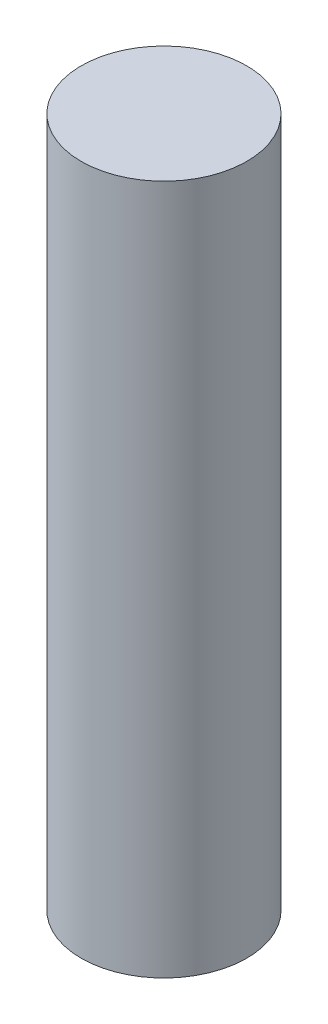
from build123d import *

# Parameters (mm, degrees)
ESBO_O1_R                = 30
RESSALTO_EXTRUS_O1_DEPTH = 250


with BuildPart() as part:
    # Esboço1 → Ressalto-extrusão1 (new body)
    with BuildSketch(Plane(origin=(0, 0, 0), x_dir=(1, 0, 0), z_dir=(0, 1, 0))):
        with Locations(Location((0, 0, 0), (0, 0, 270))):
            Circle(ESBO_O1_R)
    extrude(amount=RESSALTO_EXTRUS_O1_DEPTH)


solid = part.part
